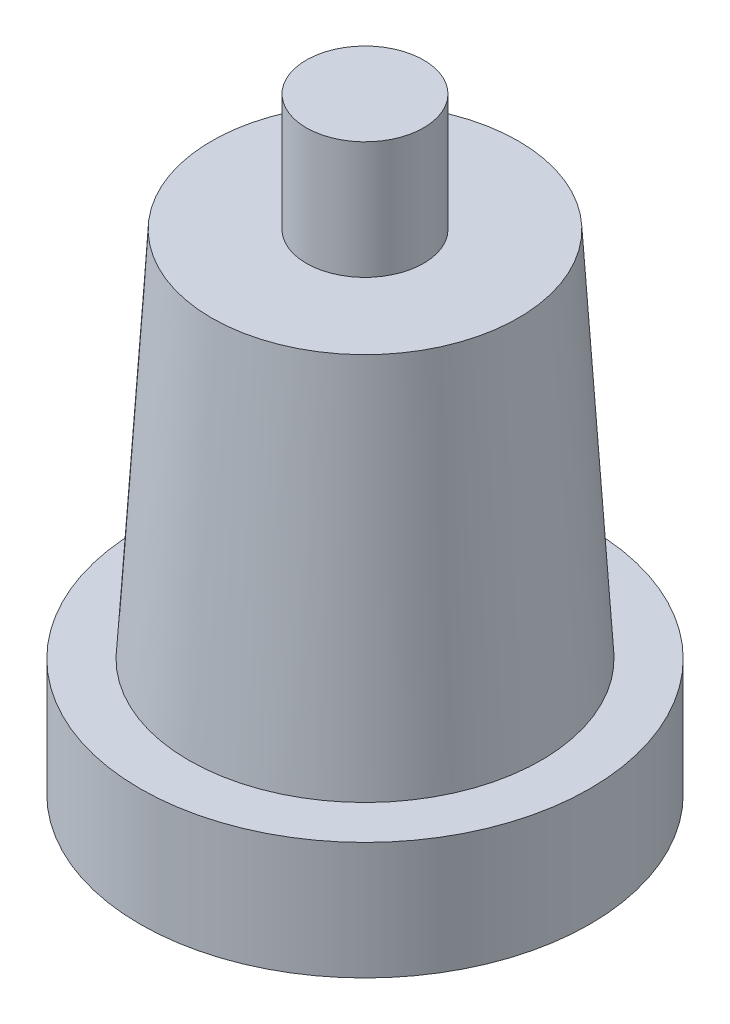
from build123d import *

# Parameters (mm, degrees)
SKETCH1_R           = 115
BOSS_EXTRUDE1_DEPTH = 60
SKETCH2_R           = 90
BOSS_EXTRUDE2_DEPTH = 190
BOSS_EXTRUDE2_TAPER = 3.5
SKETCH3_R           = 30
BOSS_EXTRUDE3_DEPTH = 60


with BuildPart() as part:
    # Sketch1 → Boss-Extrude1 (new body)
    with BuildSketch(Plane(origin=(0, 0, 0), x_dir=(1, 0, 0), z_dir=(0, 1, 0))):
        with Locations(Location((0, 0, 0), (0, 0, 270))):
            Circle(SKETCH1_R)
    extrude(amount=BOSS_EXTRUDE1_DEPTH)

    # Sketch2 → Boss-Extrude2 (add)
    with BuildSketch(Plane(origin=(0, 60, 0), x_dir=(1, 0, 0), z_dir=(0, 1, 0))):
        Circle(SKETCH2_R)
    extrude(amount=BOSS_EXTRUDE2_DEPTH, taper=BOSS_EXTRUDE2_TAPER)

    # Sketch3 → Boss-Extrude3 (add)
    with BuildSketch(Plane(origin=(0, 250, 0), x_dir=(1, 0, 0), z_dir=(0, 1, 0))):
        with Locations(Location((0, 0, 0), (0, 0, 270))):
            Circle(SKETCH3_R)
    extrude(amount=BOSS_EXTRUDE3_DEPTH)


solid = part.part
